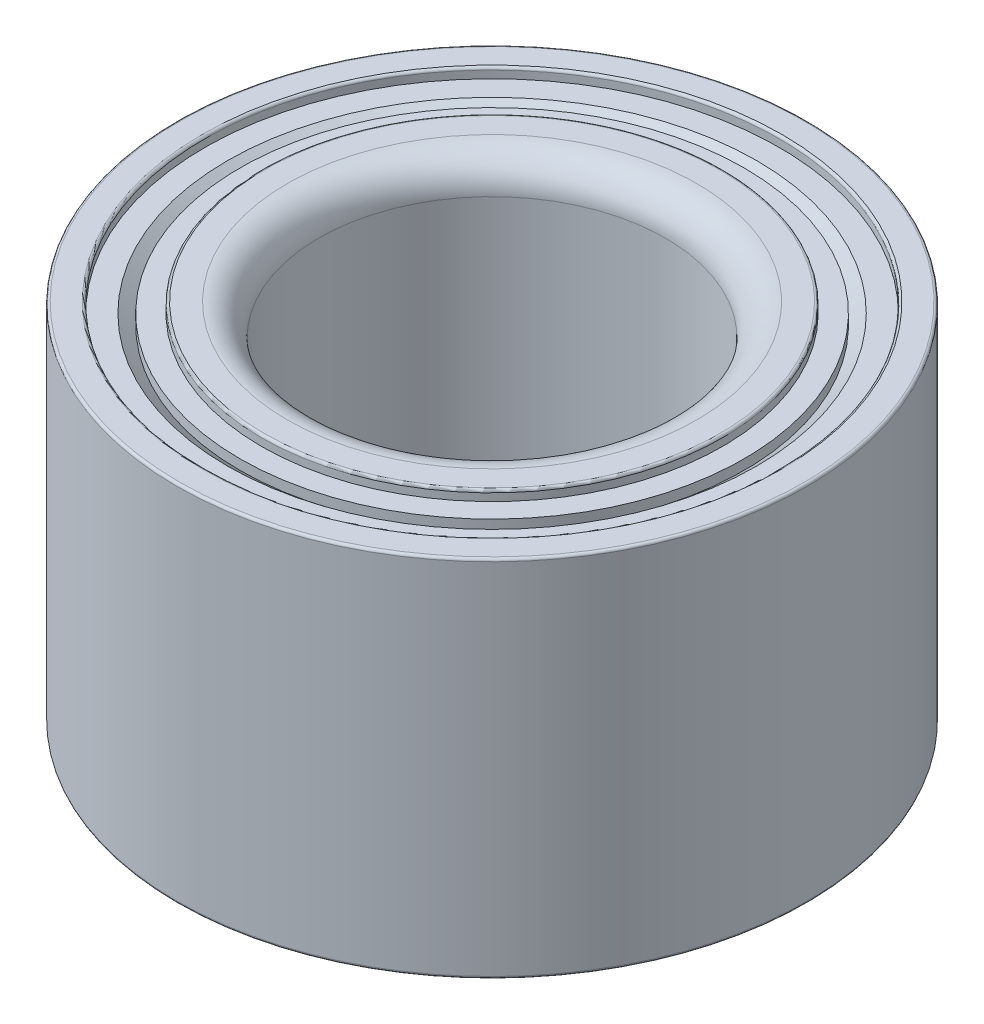
from build123d import *

# Parameters (mm, degrees)
BOSS_EXTRUDE1_DEPTH      = 18.3515
BOSS_EXTRUDE1_DEPTH_BACK = 18.3515
SKETCH1_R                = 31.75
SKETCH1_R_2              = 17.4625
SKETCH2_R                = 28.956
SKETCH2_R_2              = 23.241
CUT_EXTRUDE1_DEPTH       = 1.016
SKETCH3_R                = 26.67
SKETCH3_R_2              = 25.4
CUT_EXTRUDE2_DEPTH       = 1.016
FILLET1_R                = 3.175
FILLET2_R                = 0.254


with BuildPart() as part:
    # Sketch1 → Boss-Extrude1 (new, two sides: drawn at the far end of the back side and taken through both)
    with BuildSketch(Plane(origin=(0, 0, 0), x_dir=(1, 0, 0), z_dir=(0, 1, 0)).offset(-BOSS_EXTRUDE1_DEPTH_BACK)):
        Circle(SKETCH1_R)
        Circle(SKETCH1_R_2, mode=Mode.SUBTRACT)
    extrude(amount=BOSS_EXTRUDE1_DEPTH + BOSS_EXTRUDE1_DEPTH_BACK)

    # Sketch2 → Cut-Extrude1 (cut)
    with BuildSketch(Plane(origin=(0, 18.3515, 0), x_dir=(1, 0, 0), z_dir=(0, 1, 0))):
        Circle(SKETCH2_R)
        Circle(SKETCH2_R_2, mode=Mode.SUBTRACT)
    cut_extrude1 = extrude(amount=-CUT_EXTRUDE1_DEPTH, mode=Mode.SUBTRACT)

    # Mirror1: Cut-Extrude1 across plane
    add(cut_extrude1.mirror(Plane.ZX), mode=Mode.SUBTRACT)

    # Sketch3 → Cut-Extrude2 (cut)
    with BuildSketch(Plane.XZ.offset(17.3355)):
        Circle(SKETCH3_R)
        Circle(SKETCH3_R_2, mode=Mode.SUBTRACT)
    cut_extrude2 = extrude(amount=-CUT_EXTRUDE2_DEPTH, mode=Mode.SUBTRACT)

    # Fillet1
    fillet1_edges = [part.edges().sort_by_distance(p)[0] for p in [
        (-17.4625, -18.3515, 0),
        (-17.4625, 18.3515, 0),
    ]]
    fillet(fillet1_edges, radius=FILLET1_R)

    # Mirror4: Cut-Extrude2 across plane
    add(cut_extrude2.mirror(Plane.ZX), mode=Mode.SUBTRACT)

    # Sketch4 → Revolve1 (revolve)
    with BuildSketch(Plane(origin=(0, 0, 0), x_dir=(0, 0, -1), z_dir=(1, 0, 0))):
        Polygon((-25.4, 16.3195), (-26.67, 17.3355), (-26.67, 16.3195), align=None)
    revolve1 = revolve(axis=Axis((0, 0, 0), (0, 1, 0)))

    # Mirror5: Revolve1 across plane
    add(revolve1.mirror(Plane.ZX))

    # Fillet2
    fillet2_edges = [part.edges().sort_by_distance(p)[0] for p in [
        (-28.956, -18.3515, 0),
        (-31.75, -18.3515, 0),
        (-28.956, 18.3515, 0),
        (-31.75, 18.3515, 0),
        (-23.241, 18.3515, 0),
        (-23.241, -18.3515, 0),
    ]]
    fillet(fillet2_edges, radius=FILLET2_R)


solid = part.part
